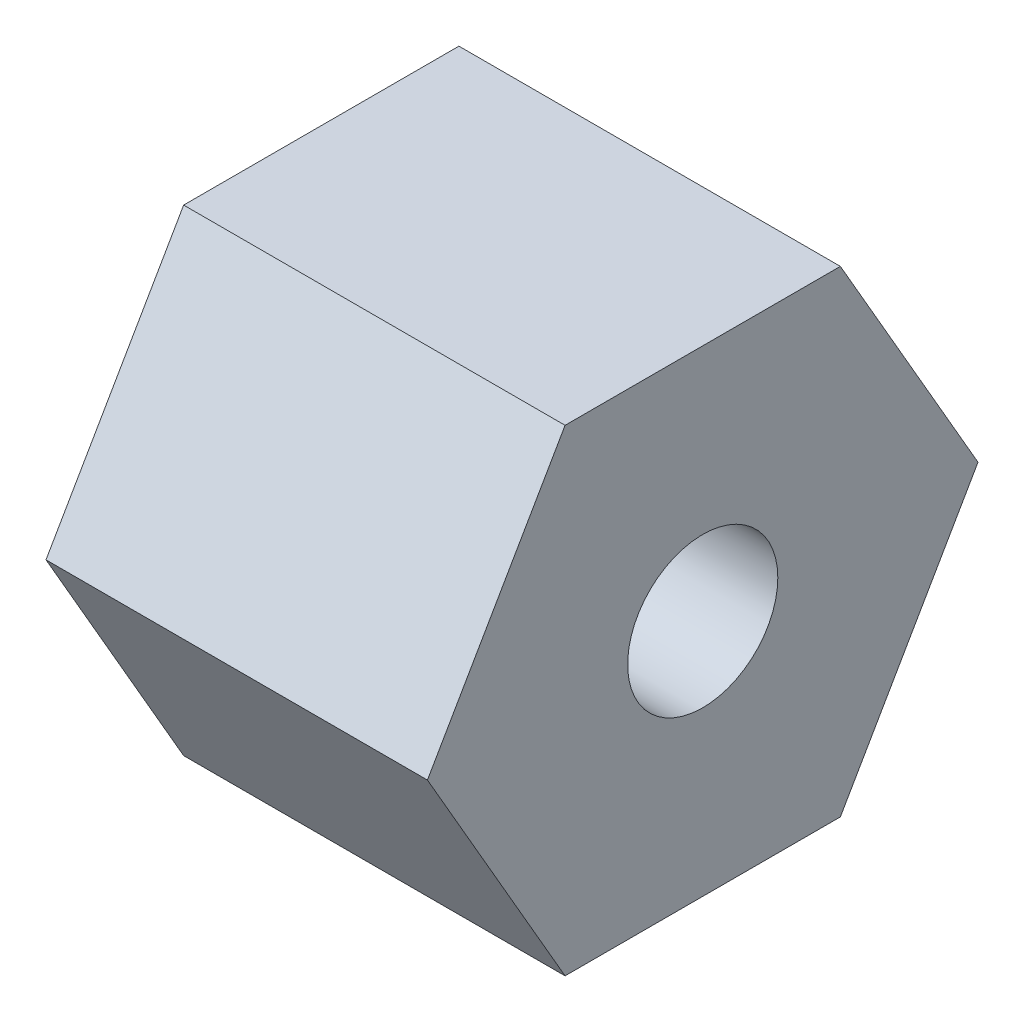
from build123d import *

# Parameters (mm, degrees)
SKETCH2_R           = 2
BOSS_EXTRUDE1_DEPTH = 5.08


with BuildPart() as part:
    # Sketch2 → Boss-Extrude1 (new, symmetric)
    with BuildSketch(Plane(origin=(0, 0, 0), x_dir=(0, 0, -1), z_dir=(1, 0, 0))):
        Polygon((7.332348419, 0), (3.666174209, 6.35), (-3.666174209, 6.35), (-7.332348419, 0), (-3.666174209, -6.35), (3.666174209, -6.35), align=None)
        Circle(SKETCH2_R, mode=Mode.SUBTRACT)
    extrude(amount=BOSS_EXTRUDE1_DEPTH, both=True)


solid = part.part
